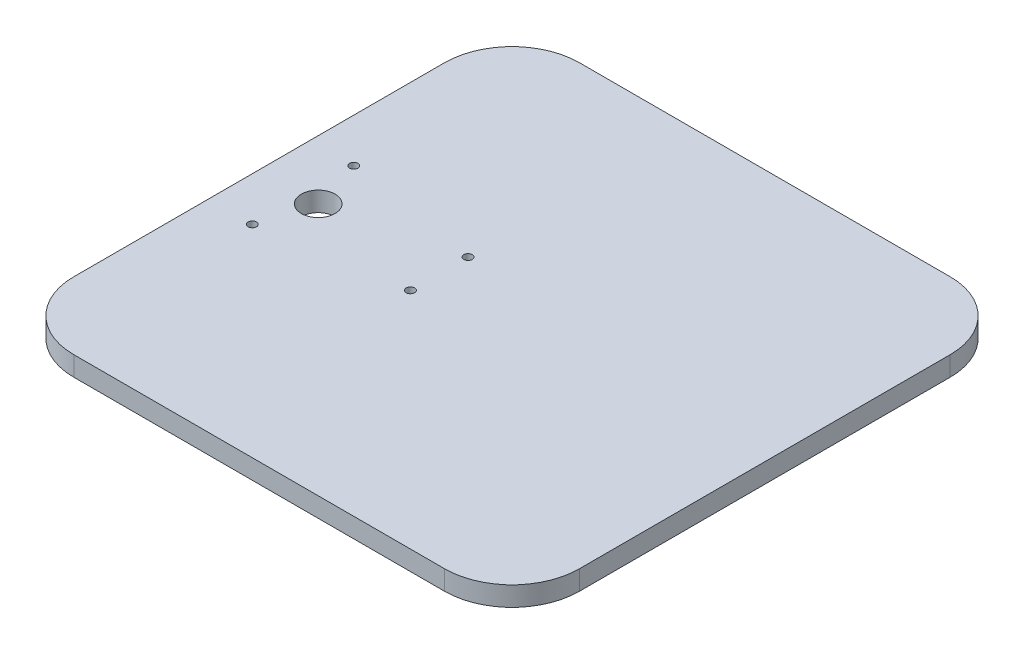
from build123d import *

# Parameters (mm, degrees)
SKETCH1_W               = 150
SKETCH1_H               = 150
BOSS_EXTRUDE1_DEPTH     = 5.8
CUT_EXTRUDE1_DEPTH      = 107.224479288
CUT_EXTRUDE1_DEPTH_BACK = 107.224479288
SKETCH2_R               = 1.25
SKETCH2_R_2             = 5
FILLET1_R               = 20
SKETCH3_R               = 6.25
CUT_EXTRUDE2_DEPTH      = 3.5


with BuildPart() as part:
    # Sketch1 → Boss-Extrude1 (new body)
    with BuildSketch(Plane(origin=(0, 0, 0), x_dir=(1, 0, 0), z_dir=(0, 1, 0))):
        Rectangle(SKETCH1_W, SKETCH1_H)
    extrude(amount=BOSS_EXTRUDE1_DEPTH)

    # Sketch2 → Cut-Extrude1 (cut, two sides: drawn at the far end of the back side and taken through both)
    with BuildSketch(Plane(origin=(0, 5.8, 0), x_dir=(1, 0, 0), z_dir=(0, 1, 0)).offset(-CUT_EXTRUDE1_DEPTH_BACK)):
        with Locations(Location((-61.985746634, -15.05, 0), (0, 0, 270))):
            Circle(SKETCH2_R)
        with Locations(Location((-61.985746634, 15.05, 0), (0, 0, 270))):
            Circle(SKETCH2_R)
        with Locations(Location((-21.585746634, 8.55, 0), (0, 0, 270))):
            Circle(SKETCH2_R)
        with Locations(Location((-21.585746634, -8.55, 0), (0, 0, 270))):
            Circle(SKETCH2_R)
        with Locations(Location((-57.485746634, 0, 0), (0, 0, 270))):
            Circle(SKETCH2_R_2)
    extrude(amount=CUT_EXTRUDE1_DEPTH + CUT_EXTRUDE1_DEPTH_BACK, mode=Mode.SUBTRACT)

    # Fillet1
    fillet1_edges = [part.edges().sort_by_distance(p)[0] for p in [
        (-75, 2.9, -75),
        (75, 2.9, -75),
        (75, 2.9, 75),
        (-75, 2.9, 75),
    ]]
    fillet(fillet1_edges, radius=FILLET1_R)

    # Sketch3 → Cut-Extrude2 (cut)
    with BuildSketch(Plane.XZ):
        with Locations(Location((-21.585746634, -8.55, 0), (0, 0, 270))):
            Circle(SKETCH3_R)
        with Locations(Location((-21.585746634, 8.55, 0), (0, 0, 270))):
            Circle(SKETCH3_R)
        with Locations(Location((-61.985746634, -15.05, 0), (0, 0, 270))):
            Circle(SKETCH3_R)
        with Locations(Location((-61.985746634, 15.05, 0), (0, 0, 270))):
            Circle(SKETCH3_R)
    extrude(amount=-CUT_EXTRUDE2_DEPTH, mode=Mode.SUBTRACT)


solid = part.part
